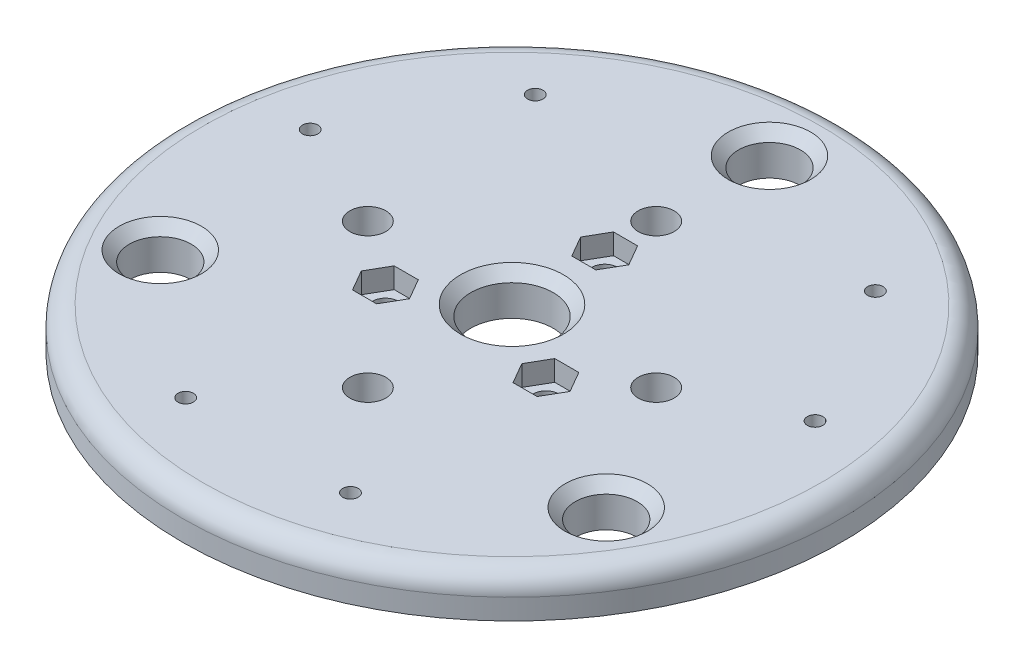
from build123d import *

# Parameters (mm, degrees)
SKETCH_1_R          = 32
SKETCH_1_R_2        = 4
SKETCH_1_R_3        = 3
EXTRUDE_1_DEPTH     = 4
FILLET_1_R          = 2
SKETCH_2_R          = 1.25
CUT_EXTRUDE_1_DEPTH = 46.431266766
SKETCH_3_R          = 1.75
CUT_EXTRUDE_2_DEPTH = 46.431266766
CUT_EXTRUDE_3_DEPTH = 2
CHAMFER_1_SIZE      = 1
SKETCH_5_R          = 0.75
CUT_EXTRUDE_4_DEPTH = 46.431266766


with BuildPart() as part:
    # Эскиз1 → Бобышка-Вытянуть1 (new body)
    with BuildSketch(Plane(origin=(0, 0, 0), x_dir=(1, 0, 0), z_dir=(0, 1, 0))):
        with Locations(Location((0, 0, 0), (0, 0, 270))):
            Circle(SKETCH_1_R)
        with Locations(Location((0, 0, 0), (0, 0, 270))):
            Circle(SKETCH_1_R_2, mode=Mode.SUBTRACT)
        with Locations(Location((0, 25, 0), (0, 0, 270))):
            Circle(SKETCH_1_R_3, mode=Mode.SUBTRACT)
        with Locations(Location((21.650635095, -12.5, 0), (0, 0, 270))):
            Circle(SKETCH_1_R_3, mode=Mode.SUBTRACT)
        with Locations(Location((-21.650635095, -12.5, 0), (0, 0, 270))):
            Circle(SKETCH_1_R_3, mode=Mode.SUBTRACT)
    extrude(amount=EXTRUDE_1_DEPTH)

    # Скругление1
    fillet_1_edges = [part.edges().sort_by_distance(p)[0] for p in [
        (0, 4, -32),
    ]]
    fillet(fillet_1_edges, radius=FILLET_1_R)

    # Эскиз2 → Вырез-Вытянуть1 (cut, through all)
    with BuildSketch(Plane(origin=(0, 4, 0), x_dir=(1, 0, 0), z_dir=(0, 1, 0))):
        with Locations(Location((0, 9, 0), (0, 0, 270))):
            Circle(SKETCH_2_R)
        with Locations(Location((7.794228634, -4.5, 0), (0, 0, 270))):
            Circle(SKETCH_2_R)
        with Locations(Location((-7.794228634, -4.5, 0), (0, 0, 270))):
            Circle(SKETCH_2_R)
    extrude(amount=-CUT_EXTRUDE_1_DEPTH, mode=Mode.SUBTRACT)

    # Эскиз3 → Вырез-Вытянуть2 (cut, through all)
    with BuildSketch(Plane.XZ):
        with Locations(Location((0, 14, 0), (0, 0, 270))):
            Circle(SKETCH_3_R)
        with Locations(Location((14, 0, 0), (0, 0, 270))):
            Circle(SKETCH_3_R)
        with Locations(Location((0, -14, 0), (0, 0, 270))):
            Circle(SKETCH_3_R)
        with Locations(Location((-14, 0, 0), (0, 0, 270))):
            Circle(SKETCH_3_R)
    extrude(amount=-CUT_EXTRUDE_2_DEPTH, mode=Mode.SUBTRACT)

    # Эскиз4 → Вырез-Вытянуть3 (cut)
    with BuildSketch(Plane(origin=(0, 4, 0), x_dir=(1, 0, 0), z_dir=(0, 1, 0))):
        Polygon((5.455960044, -4.5), (6.625094339, -6.525), (8.963362929, -6.525), (10.132497224, -4.5), (8.963362929, -2.475), (6.625094339, -2.475), align=None)
        Polygon((1.169134295, 6.975), (2.33826859, 9), (1.169134295, 11.025), (-1.169134295, 11.025), (-2.33826859, 9), (-1.169134295, 6.975), align=None)
        Polygon((-6.625094339, -2.475), (-8.963362929, -2.475), (-10.132497224, -4.5), (-8.963362929, -6.525), (-6.625094339, -6.525), (-5.455960044, -4.5), align=None)
    extrude(amount=-CUT_EXTRUDE_3_DEPTH, mode=Mode.SUBTRACT)

    # Фаска1
    chamfer_1_edges = [part.edges().sort_by_distance(p)[0] for p in [
        (21.650635095, 4, 9.5),
        (-21.650635095, 4, 9.5),
        (0, 4, -4),
        (0, 4, -28),
    ]]
    chamfer(chamfer_1_edges, length=CHAMFER_1_SIZE)

    # Эскиз5 → Вырез-Вытянуть4 (cut, through all)
    with BuildSketch(Plane(origin=(0, 4, 0), x_dir=(1, 0, 0), z_dir=(0, 1, 0))):
        with Locations(Location((-8, -23.685438565, 0), (0, 0, 270))):
            Circle(SKETCH_5_R)
        with Locations(Location((8, -23.685438565, 0), (0, 0, 270))):
            Circle(SKETCH_5_R)
        with Locations(Location((-16.512191497, 18.770922513, 0), (0, 0, 270))):
            Circle(SKETCH_5_R)
        with Locations(Location((-24.512191497, 4.914516052, 0), (0, 0, 270))):
            Circle(SKETCH_5_R)
        with Locations(Location((24.512191497, 4.914516052, 0), (0, 0, 270))):
            Circle(SKETCH_5_R)
        with Locations(Location((16.512191497, 18.770922513, 0), (0, 0, 270))):
            Circle(SKETCH_5_R)
    extrude(amount=-CUT_EXTRUDE_4_DEPTH, mode=Mode.SUBTRACT)


solid = part.part
